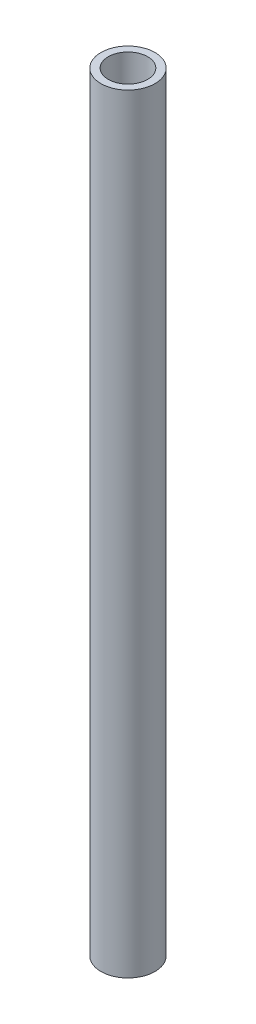
from build123d import *

# Parameters (mm, degrees)
SKETCH1_R           = 4.25
SKETCH1_R_2         = 3.1
BOSS_EXTRUDE1_DEPTH = 121


with BuildPart() as part:
    # Sketch1 → Boss-Extrude1 (new body)
    with BuildSketch(Plane(origin=(0, 0, 0), x_dir=(1, 0, 0), z_dir=(0, 1, 0))):
        with Locations(Location((0, 0, 0), (0, 0, 270))):
            Circle(SKETCH1_R)
        with Locations(Location((0, 0, 0), (0, 0, 270))):
            Circle(SKETCH1_R_2, mode=Mode.SUBTRACT)
    extrude(amount=BOSS_EXTRUDE1_DEPTH)


solid = part.part
